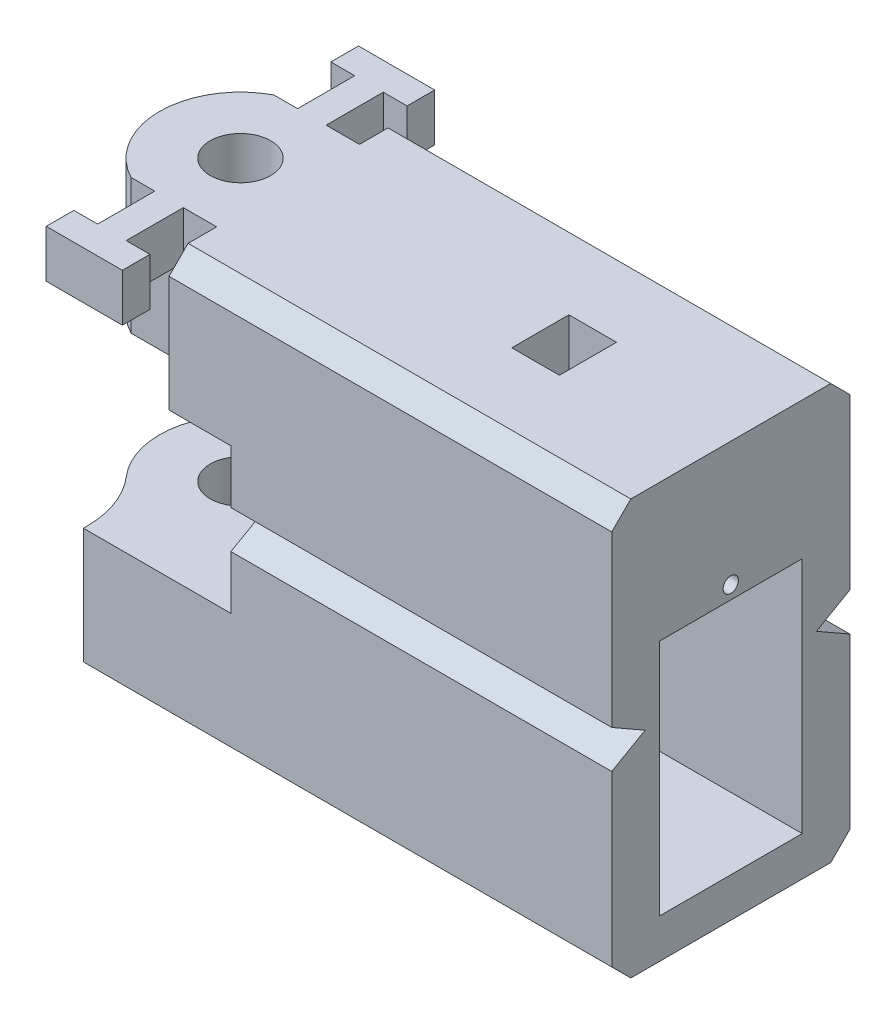
from build123d import *

# Parameters (mm, degrees)
BOSS_EXTRUDE1_DEPTH = 55.5
CHAMFER1_SIZE       = 2
SKETCH4_W           = 8
SKETCH4_H           = 32.8
BOSS_EXTRUDE2_DEPTH = 5
SKETCH7_W           = 3.5
SKETCH7_H           = 6
CUT_EXTRUDE5_DEPTH  = 10
SKETCH5_R           = 3.175
CUT_EXTRUDE3_DEPTH  = 77.250596562
SKETCH6_R           = 3.175
CUT_EXTRUDE4_DEPTH  = 7.62
SKETCH8_W           = 9
SKETCH8_H           = 5
CUT_EXTRUDE6_DEPTH  = 9.167
BOSS_EXTRUDE3_DEPTH = 14.167
BOSS_EXTRUDE4_START = -29.407
BOSS_EXTRUDE4_DEPTH = 14.167
FILLET1_R           = 10
SKETCH10_W          = 15
SKETCH10_H          = 25
CUT_EXTRUDE7_DEPTH  = 20
SKETCH11_R          = 0.8
CUT_EXTRUDE8_DEPTH  = 8
SKETCH12_W          = 5
SKETCH12_H          = 6
CUT_EXTRUDE9_DEPTH  = 14.437


with BuildPart() as part:
    # Sketch1 → Boss-Extrude1 (new body)
    with BuildSketch(Plane(origin=(0, 0, 0), x_dir=(0, 0, -1), z_dir=(1, 0, 0))):
        Polygon((0, 0), (25, 0), (25, 19.787), (21.5, 21.787), (25, 23.787), (25, 43.574), (0, 43.574), (0, 23.787), (3.5, 21.787), (0, 19.787), align=None)
    extrude(amount=BOSS_EXTRUDE1_DEPTH)

    # Chamfer1
    chamfer1_edges = [part.edges().sort_by_distance(p)[0] for p in [
        (27.75, 43.574, 0),
        (27.75, 43.574, -25),
        (27.75, 0, -25),
        (27.75, 0, 0),
    ]]
    chamfer(chamfer1_edges, length=CHAMFER1_SIZE)

    # Sketch4 → Boss-Extrude2 (add)
    with BuildSketch(Plane(origin=(0, 43.574, 0), x_dir=(1, 0, 0), z_dir=(0, 1, 0))):
        with Locations((4, 12.5)):
            Rectangle(SKETCH4_W, SKETCH4_H)
    extrude(amount=-BOSS_EXTRUDE2_DEPTH)

    # Sketch7 → Cut-Extrude5 (cut)
    with BuildSketch(Plane(origin=(0, 43.574, 0), x_dir=(1, 0, 0), z_dir=(0, 1, 0))):
        with Locations((7.25, 2)):
            Rectangle(SKETCH7_W, SKETCH7_H)
        with Locations((7.25, 23)):
            Rectangle(SKETCH7_W, SKETCH7_H)
        with Locations((0.75, 2)):
            Rectangle(SKETCH7_W, SKETCH7_H)
        with Locations((0.75, 23)):
            Rectangle(SKETCH7_W, SKETCH7_H)
    extrude(amount=-CUT_EXTRUDE5_DEPTH, mode=Mode.SUBTRACT)

    # Sketch5 → Cut-Extrude3 (cut, through all)
    with BuildSketch(Plane(origin=(0, 43.574, 0), x_dir=(1, 0, 0), z_dir=(0, 1, 0))):
        with Locations(Location((4, 12.5, 0), (0, 0, 270))):
            Circle(SKETCH5_R)
    extrude(amount=-CUT_EXTRUDE3_DEPTH, mode=Mode.SUBTRACT)

    # Sketch6 → Cut-Extrude4 (cut, symmetric)
    with BuildSketch(Plane(origin=(0, 21.787, 0), x_dir=(-1, 0, 0), z_dir=(0, -1, 0))):
        Polygon((-4, 30), (4.5, 30), (4.5, -5), (-4, -5), (-15.5, -5), (-15.5, 30), align=None)
        with Locations(Location((-4, 12.5, 0), (0, 0, 270))):
            Circle(SKETCH6_R, mode=Mode.SUBTRACT)
    extrude(amount=CUT_EXTRUDE4_DEPTH, both=True, mode=Mode.SUBTRACT)

    # Sketch8 → Cut-Extrude6 (cut)
    with BuildSketch(Plane.XZ.offset(-29.407)):
        with Locations((4.5, -22.5)):
            Rectangle(SKETCH8_W, SKETCH8_H)
        with Locations((4.5, -2.5)):
            Rectangle(SKETCH8_W, SKETCH8_H)
    extrude(amount=-CUT_EXTRUDE6_DEPTH, mode=Mode.SUBTRACT)

    # Sketch9 → Boss-Extrude3 (add)
    with BuildSketch(Plane(origin=(0, 43.574, 0), x_dir=(1, 0, 0), z_dir=(0, 1, 0))):
        with BuildLine():
            Line((0, 20), (0, 5))
            ThreePointArc((0, 5), (-4.5, 12.5), (0, 20))
        make_face()
    extrude(amount=-BOSS_EXTRUDE3_DEPTH)

    # Sketch9<2> → Boss-Extrude4 (add)
    with BuildSketch(Plane(origin=(0, 43.574, 0), x_dir=(1, 0, 0), z_dir=(0, 1, 0)).offset(BOSS_EXTRUDE4_START)):
        with BuildLine():
            Line((0, 20), (0, 5))
            ThreePointArc((0, 5), (-4.5, 12.5), (0, 20))
        make_face()
    extrude(amount=-BOSS_EXTRUDE4_DEPTH)

    # Fillet1
    fillet1_edges = [part.edges().sort_by_distance(p)[0] for p in [
        (0, 7.0835, -20),
        (0, 7.0835, -5),
    ]]
    fillet(fillet1_edges, radius=FILLET1_R)

    # Sketch10 → Cut-Extrude7 (cut)
    with BuildSketch(Plane(origin=(55.5, 0, 0), x_dir=(0, 0, -1), z_dir=(1, 0, 0))):
        with Locations((12.5, 16.637)):
            Rectangle(SKETCH10_W, SKETCH10_H)
    extrude(amount=-CUT_EXTRUDE7_DEPTH, mode=Mode.SUBTRACT)

    # Sketch11 → Cut-Extrude8 (cut)
    with BuildSketch(Plane(origin=(55.5, 0, 0), x_dir=(0, 0, -1), z_dir=(1, 0, 0))):
        with Locations((12.5, 30.537)):
            Circle(SKETCH11_R)
    extrude(amount=-CUT_EXTRUDE8_DEPTH, mode=Mode.SUBTRACT)

    # Sketch12 → Cut-Extrude9 (cut)
    with BuildSketch(Plane(origin=(0, 43.574, 0), x_dir=(1, 0, 0), z_dir=(0, 1, 0))):
        with Locations((38, 12.5)):
            Rectangle(SKETCH12_W, SKETCH12_H)
    extrude(amount=-CUT_EXTRUDE9_DEPTH, mode=Mode.SUBTRACT)


solid = part.part
